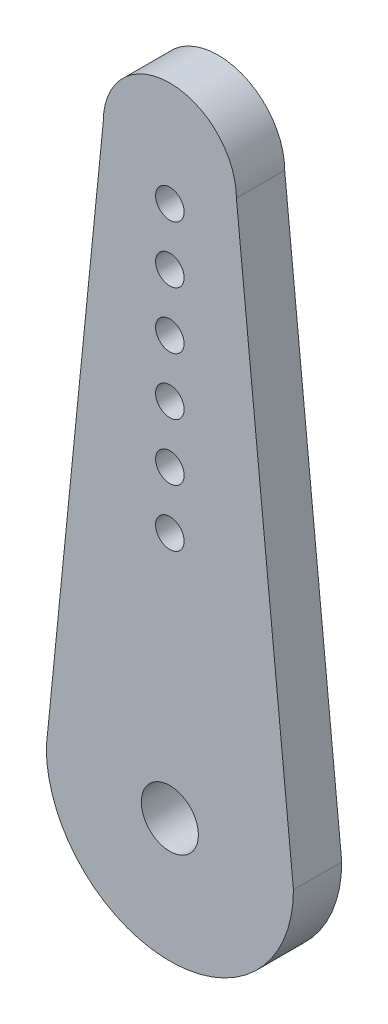
from build123d import *

# Parameters (mm, degrees)
ESQUISSE1_R        = 1.5
ESQUISSE1_R_2      = 0.75
BOSS_EXTRU_1_DEPTH = 2.54


with BuildPart() as part:
    # Esquisse1 → Boss.-Extru.1 (new body)
    with BuildSketch(Plane.XY):
        with BuildLine():
            Line((-3.5, 30), (-6.5, 0))
            ThreePointArc((-6.5, 0), (0, -6.5), (6.5, 0))
            Line((6.5, 0), (3.5, 30))
            ThreePointArc((3.5, 30), (0, 33.5), (-3.5, 30))
        make_face()
        Circle(ESQUISSE1_R, mode=Mode.SUBTRACT)
        with Locations((0, 13)):
            Circle(ESQUISSE1_R_2, mode=Mode.SUBTRACT)
        with Locations((0, 16)):
            Circle(ESQUISSE1_R_2, mode=Mode.SUBTRACT)
        with Locations((0, 19)):
            Circle(ESQUISSE1_R_2, mode=Mode.SUBTRACT)
        with Locations((0, 22)):
            Circle(ESQUISSE1_R_2, mode=Mode.SUBTRACT)
        with Locations((0, 25)):
            Circle(ESQUISSE1_R_2, mode=Mode.SUBTRACT)
        with Locations((0, 28)):
            Circle(ESQUISSE1_R_2, mode=Mode.SUBTRACT)
    extrude(amount=BOSS_EXTRU_1_DEPTH)


solid = part.part
